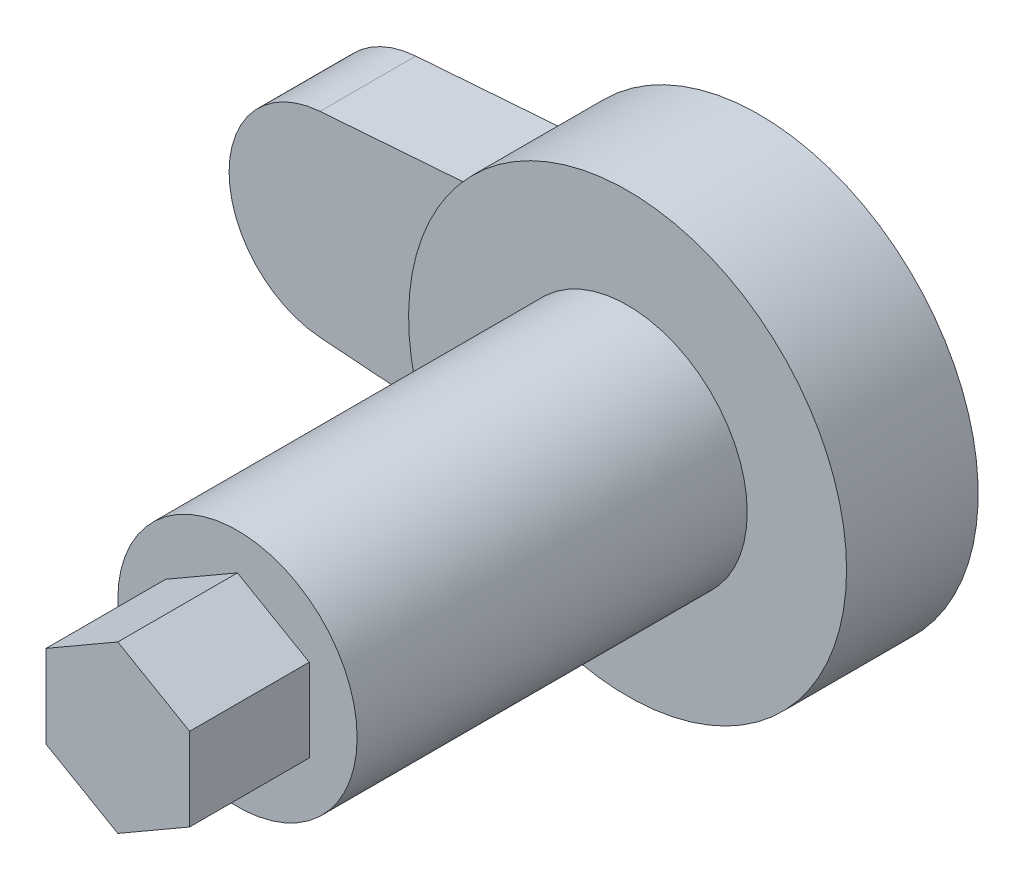
from build123d import *

# Parameters (mm, degrees)
BOSS_EXTRUDE2_DEPTH = 4
SKETCH9_R           = 9.15
BOSS_EXTRUDE5_DEPTH = 5.5
CUT_EXTRUDE1_DEPTH  = 3
SKETCH7_R           = 5
BOSS_EXTRUDE3_DEPTH = 16.3
BOSS_EXTRUDE4_DEPTH = 5


with BuildPart() as part:
    # Sketch6 → Boss-Extrude2 (new body)
    with BuildSketch(Plane.XY):
        with BuildLine():
            Line((-14.350884997, -4.088944634), (-2.486150771, -4.962011119))
            ThreePointArc((-2.486150771, -4.962011119), (5.55, 0), (-2.486150771, 4.962011119))
            Line((-2.486150771, 4.962011119), (-14.350884997, 4.088944634))
            ThreePointArc((-14.350884997, 4.088944634), (-18.15, 0), (-14.350884997, -4.088944634))
        make_face()
    extrude(amount=BOSS_EXTRUDE2_DEPTH)

    # Sketch9 → Boss-Extrude5 (add)
    with BuildSketch(Plane.XY):
        with Locations(Location((0, 0, 0), (0, 0, 150.099187437))):
            Circle(SKETCH9_R)
    extrude(amount=BOSS_EXTRUDE5_DEPTH)

    # Sketch11 → Cut-Extrude1 (cut)
    with BuildSketch(Plane(origin=(0, 0, 0), x_dir=(-1, 0, 0), z_dir=(0, 0, -1))):
        with BuildLine():
            Line((14.204111828, 2.094337495), (1.898238311, 2.999865216))
            ThreePointArc((1.898238311, 2.999865216), (-3.55, 0), (1.898238311, -2.999865216))
            Line((1.898238311, -2.999865216), (14.204111828, -2.094337495))
            ThreePointArc((14.204111828, -2.094337495), (16.15, 0), (14.204111828, 2.094337495))
        make_face()
    extrude(amount=-CUT_EXTRUDE1_DEPTH, mode=Mode.SUBTRACT)

    # Sketch7 → Boss-Extrude3 (add)
    with BuildSketch(Plane.XY.offset(5.5)):
        Circle(SKETCH7_R)
    extrude(amount=BOSS_EXTRUDE3_DEPTH)

    # Sketch8 → Boss-Extrude4 (add)
    with BuildSketch(Plane.XY.offset(21.8)):
        Polygon((0, 3.464101615), (-3, 1.732050808), (-3, -1.732050808), (0, -3.464101615), (3, -1.732050808), (3, 1.732050808), align=None)
    extrude(amount=BOSS_EXTRUDE4_DEPTH)


solid = part.part
